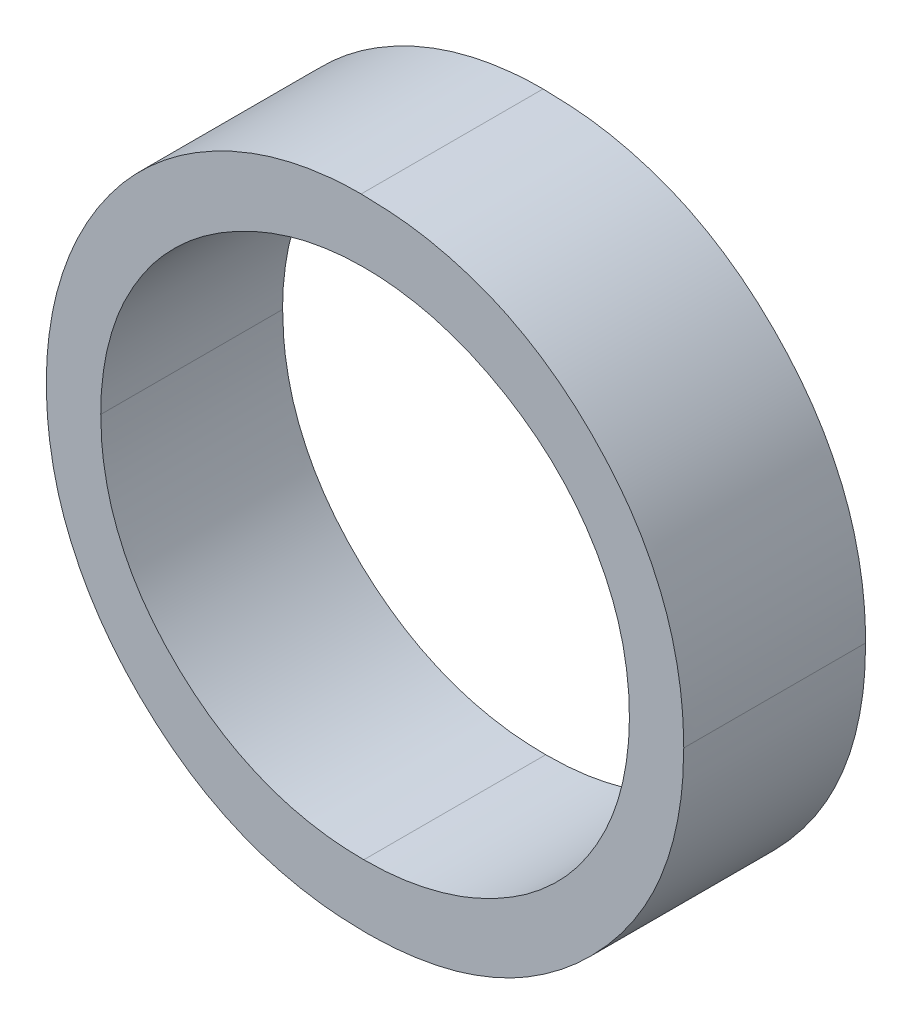
from build123d import *

# Parameters (mm, degrees)
BOSS_EXTRU_1_DEPTH = 1.5


with BuildPart() as part:
    # Esquisse1 → Boss.-Extru.1 (new body)
    with BuildSketch(Plane.XY):
        with BuildLine():
            add(Edge.make_bspline(
                [(-53.092721736, -17.741913948), (-53.000138728, -17.744258919), (-52.818298061, -17.748864634), (-52.551048207, -17.784120496), (-52.295912356, -17.845113911), (-52.050812158, -17.926346743), (-51.818679334, -18.03471015), (-51.597766631, -18.165688934), (-51.388599668, -18.320655303), (-51.193997695, -18.498411342), (-51.015916337, -18.691816276), (-50.859022214, -18.89821329), (-50.727533223, -19.116354436), (-50.619553527, -19.345584195), (-50.534841227, -19.585384149), (-50.476385451, -19.837032724), (-50.439045236, -20.098899424), (-50.43467984, -20.277509231), (-50.432465326, -20.368115871)],
                knots=[0, 0, 0, 0, 1.065120563, 2.091984664, 3.0946048, 4.079830382, 5.057816894, 6.036188127, 7.030412546, 8.04752943, 9.064399622, 10.05169764, 11.02544977, 11.989514704, 12.962713494, 13.945757189, 14.957906945, 16, 16, 16, 16], degree=3))
            add(Edge.make_bspline(
                [(-50.432465326, -20.368115871), (-50.434679515, -20.45805508), (-50.439043939, -20.635335681), (-50.476427907, -20.895540601), (-50.535057907, -21.145670167), (-50.618766858, -21.385306814), (-50.726231828, -21.614703334), (-50.858596358, -21.833256125), (-51.014512373, -22.041036837), (-51.191950732, -22.235769216), (-51.385380792, -22.414337031), (-51.592852602, -22.569935425), (-51.809700201, -22.703827032), (-52.03871407, -22.810660852), (-52.27685698, -22.896049309), (-52.526260299, -22.954267352), (-52.785755376, -22.991820271), (-52.962713953, -22.996132437), (-53.052657634, -22.998324204)],
                knots=[0, 0, 0, 0, 1.043624062, 2.057103931, 3.04512605, 4.022047818, 4.998200453, 5.980619268, 6.982898556, 8.009068085, 9.034988726, 10.034168286, 11.015286542, 11.987931943, 12.962482838, 13.94673481, 14.956375938, 16, 16, 16, 16], degree=3))
            add(Edge.make_bspline(
                [(-53.052657634, -22.998324204), (-53.143263804, -22.996110795), (-53.321872683, -22.991747575), (-53.584068448, -22.954345568), (-53.835893797, -22.895857991), (-54.076628584, -22.812273082), (-54.306407055, -22.704248467), (-54.525678602, -22.572527925), (-54.733563098, -22.416232009), (-54.928337021, -22.238851188), (-55.106550162, -22.045748971), (-55.261920698, -21.838842893), (-55.39367086, -21.62219224), (-55.501332764, -21.395195777), (-55.586567706, -21.158950859), (-55.644717446, -20.911881606), (-55.682340234, -20.655396597), (-55.686675729, -20.480763885), (-55.688875582, -20.392154333)],
                knots=[0, 0, 0, 0, 1.053102029, 2.075944431, 3.073151272, 4.055350789, 5.033113405, 6.020478099, 7.024410459, 8.052272461, 9.079885166, 10.07527673, 11.055994387, 12.023226415, 12.992069828, 13.970394897, 14.97016774, 16, 16, 16, 16], degree=3))
            add(Edge.make_bspline(
                [(-55.688875582, -20.392154333), (-55.688111817, -20.332679091), (-55.686593922, -20.214478915), (-55.668320076, -20.0389552), (-55.64180336, -19.86625426), (-55.603800628, -19.696867192), (-55.554098246, -19.531208642), (-55.495452493, -19.368136124), (-55.423824143, -19.209302233), (-55.342851788, -19.05395453), (-55.252477777, -18.904514665), (-55.152655278, -18.763258118), (-55.046890465, -18.628999551), (-54.93094276, -18.505218117), (-54.808633553, -18.388312893), (-54.677978727, -18.28008044), (-54.539775521, -18.179544796), (-54.393429264, -18.088944309), (-54.242546014, -18.007002688), (-54.08700776, -17.936685758), (-53.928926944, -17.876334242), (-53.767563161, -17.827418777), (-53.603344915, -17.788801583), (-53.435913794, -17.762505363), (-53.265403185, -17.744184909), (-53.150529872, -17.742674192), (-53.092721736, -17.741913948)],
                knots=[0, 0, 0, 0, 1.037015668, 2.060948919, 3.074880161, 4.083647147, 5.086022904, 6.090072063, 7.104153813, 8.122640571, 9.144368836, 10.147691507, 11.138137339, 12.123020368, 13.103399296, 14.087645067, 15.080126199, 16.082011238, 17.087798457, 18.072939717, 19.057185487, 20.037253025, 21.01195951, 21.997135196, 22.992090687, 24, 24, 24, 24], degree=3))
        make_face()
        with BuildLine():
            add(Edge.make_bspline(
                [(-53.07068648, -18.254734461), (-53.118135956, -18.255312875), (-53.212581289, -18.256464175), (-53.352987769, -18.271629483), (-53.491547675, -18.29324361), (-53.628289621, -18.324074354), (-53.762641463, -18.366080144), (-53.895855522, -18.414424298), (-54.026717027, -18.473311571), (-54.154793967, -18.539844005), (-54.27895836, -18.613485321), (-54.396119362, -18.694873559), (-54.506580282, -18.782100066), (-54.610070663, -18.875368405), (-54.706286623, -18.97515355), (-54.797121911, -19.079942745), (-54.878935599, -19.19273116), (-54.953914994, -19.310460313), (-55.021011909, -19.432976858), (-55.080676702, -19.558990947), (-55.129482428, -19.689530499), (-55.169285823, -19.823179296), (-55.202285553, -19.959725667), (-55.223191159, -20.100205451), (-55.238523101, -20.243912754), (-55.239608594, -20.341029688), (-55.240157634, -20.390151128)],
                knots=[0, 0, 0, 0, 1.008559885, 2.007477868, 2.99961109, 3.989939068, 4.984837346, 5.991145699, 7.001802488, 8.033829008, 9.059044045, 10.069351652, 11.065060232, 12.050310815, 13.029377138, 14.011219647, 14.996725999, 15.989392538, 16.977580475, 17.965360261, 18.951710183, 19.937753436, 20.929683414, 21.935841486, 22.955955122, 24, 24, 24, 24], degree=3))
            add(Edge.make_bspline(
                [(-55.240157634, -20.390151128), (-55.238336402, -20.462382872), (-55.234753477, -20.604485058), (-55.203385519, -20.812725263), (-55.155068413, -21.012851387), (-55.083843604, -21.2037684), (-54.994771297, -21.387117375), (-54.884732882, -21.561271811), (-54.75436276, -21.726278774), (-54.606272008, -21.880986301), (-54.444382427, -22.022194593), (-54.272478527, -22.146142319), (-54.092401945, -22.251014105), (-53.903683084, -22.336449923), (-53.707329457, -22.404149548), (-53.502075813, -22.450547592), (-53.289289442, -22.481083957), (-53.144245649, -22.484016466), (-53.07068648, -22.485503692)],
                knots=[0, 0, 0, 0, 1.032063989, 2.030389145, 3.003944642, 3.970395727, 4.937377036, 5.913328081, 6.909231446, 7.93887556, 8.970685674, 9.976071282, 10.964166581, 11.944589148, 12.933237628, 13.927779006, 14.949070134, 16, 16, 16, 16], degree=3))
            add(Edge.make_bspline(
                [(-53.07068648, -22.485503692), (-53.021244335, -22.4848244), (-52.923185711, -22.48347716), (-52.777334965, -22.469907621), (-52.634111805, -22.448147808), (-52.49371712, -22.4168183), (-52.356310246, -22.377608005), (-52.22131767, -22.331025536), (-52.090177256, -22.272909531), (-51.96123463, -22.208698172), (-51.837811428, -22.135497947), (-51.719989239, -22.056872019), (-51.610737839, -21.969773989), (-51.50732488, -21.8778914), (-51.410713896, -21.779371617), (-51.321558204, -21.674342729), (-51.240158015, -21.56214179), (-51.165207091, -21.44459121), (-51.098345287, -21.321739421), (-51.040089432, -21.195268452), (-50.990666409, -21.065489725), (-50.950768545, -20.932216051), (-50.9195036, -20.795700553), (-50.897960857, -20.655760441), (-50.882891659, -20.512675666), (-50.881755834, -20.415898729), (-50.881183275, -20.367114269)],
                knots=[0, 0, 0, 0, 1.047197238, 2.076906641, 3.100256066, 4.114471768, 5.12198147, 6.126382909, 7.136867548, 8.15857795, 9.17633901, 10.174870724, 11.156907918, 12.133735059, 13.104061851, 14.077631395, 15.04955518, 16.038496417, 17.029181396, 18.010275684, 18.986308667, 19.968651475, 20.955262928, 21.950658345, 22.966943676, 24, 24, 24, 24], degree=3))
            add(Edge.make_bspline(
                [(-50.881183275, -20.367114269), (-50.881756293, -20.318663548), (-50.882892981, -20.222552619), (-50.897953659, -20.080465736), (-50.91952636, -19.941532577), (-50.950615942, -19.806298572), (-50.990687591, -19.674729251), (-51.040098063, -19.546948183), (-51.098362776, -19.422479333), (-51.165231668, -19.301630337), (-51.24039713, -19.185666426), (-51.322531764, -19.074805836), (-51.413053689, -18.971130491), (-51.509376582, -18.872080929), (-51.613906418, -18.779769658), (-51.726169696, -18.694166057), (-51.844803521, -18.613204236), (-51.970413857, -18.540167719), (-52.100048077, -18.472718816), (-52.233068017, -18.414931668), (-52.367966731, -18.36582864), (-52.504401177, -18.323947262), (-52.643519717, -18.293364362), (-52.78438233, -18.271610005), (-52.926794128, -18.256469453), (-53.022570156, -18.255314627), (-53.07068648, -18.254734461)],
                knots=[0, 0, 0, 0, 1.02996197, 2.043119294, 3.035359645, 4.018872909, 4.991431989, 5.957985074, 6.929999688, 7.912076566, 8.892894881, 9.867085534, 10.843653904, 11.817741046, 12.803660682, 13.806313499, 14.818574707, 15.856120519, 16.894564902, 17.924820532, 18.937903209, 19.946497019, 20.957711757, 21.963978472, 22.977135795, 24, 24, 24, 24], degree=3))
        make_face(mode=Mode.SUBTRACT)
    extrude(amount=BOSS_EXTRU_1_DEPTH)


solid = part.part
